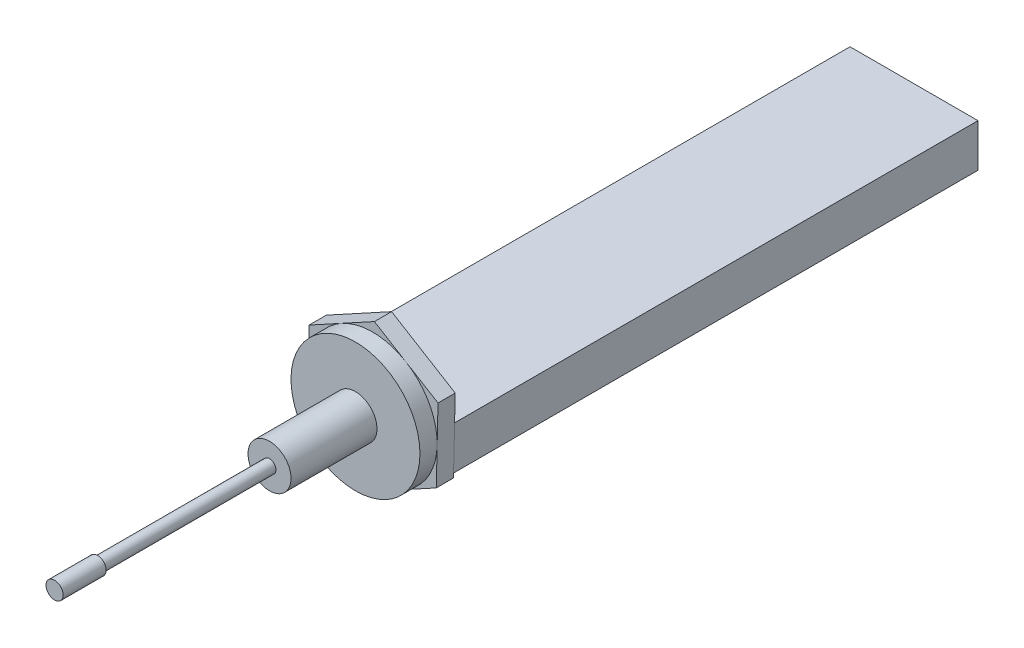
from build123d import *

# Parameters (mm, degrees)
BOSS_EXTRUDE1_DEPTH = 2
SKETCH2_R           = 7.5
BOSS_EXTRUDE2_DEPTH = 2
SKETCH3_R           = 2.5
BOSS_EXTRUDE3_DEPTH = 10
SKETCH4_R           = 0.75
BOSS_EXTRUDE4_DEPTH = 20
SKETCH5_R           = 1
BOSS_EXTRUDE5_DEPTH = 5
SKETCH6_W           = 14.887597411
SKETCH6_H           = 5
BOSS_EXTRUDE6_DEPTH = 61


with BuildPart() as part:
    # Sketch1 → Boss-Extrude1 (new body)
    with BuildSketch(Plane.XY):
        Polygon((7.397125851, -4.5036129), (7.598806105, 4.154292452), (0.201680255, 8.657905351), (-7.397125851, 4.5036129), (-7.598806105, -4.154292452), (-0.201680255, -8.657905351), align=None)
    extrude(amount=-BOSS_EXTRUDE1_DEPTH)

    # Sketch2 → Boss-Extrude2 (add)
    with BuildSketch(Plane.XY):
        with Locations(Location((0, 0, 0), (0, 0, 178.665573541))):
            Circle(SKETCH2_R)
    extrude(amount=BOSS_EXTRUDE2_DEPTH)

    # Sketch3 → Boss-Extrude3 (add)
    with BuildSketch(Plane.XY.offset(2)):
        Circle(SKETCH3_R)
    extrude(amount=BOSS_EXTRUDE3_DEPTH)

    # Sketch4 → Boss-Extrude4 (add)
    with BuildSketch(Plane.XY.offset(12)):
        Circle(SKETCH4_R)
    extrude(amount=BOSS_EXTRUDE4_DEPTH)

    # Sketch5 → Boss-Extrude5 (add)
    with BuildSketch(Plane.XY.offset(32)):
        Circle(SKETCH5_R)
    extrude(amount=BOSS_EXTRUDE5_DEPTH)

    # Sketch6 → Boss-Extrude6 (add)
    with BuildSketch(Plane(origin=(0, 0, -2), x_dir=(-1, 0, 0), z_dir=(0, 0, -1))):
        with Locations((0.034941521, -1.5)):
            Rectangle(SKETCH6_W, SKETCH6_H)
    extrude(amount=BOSS_EXTRUDE6_DEPTH)


solid = part.part
